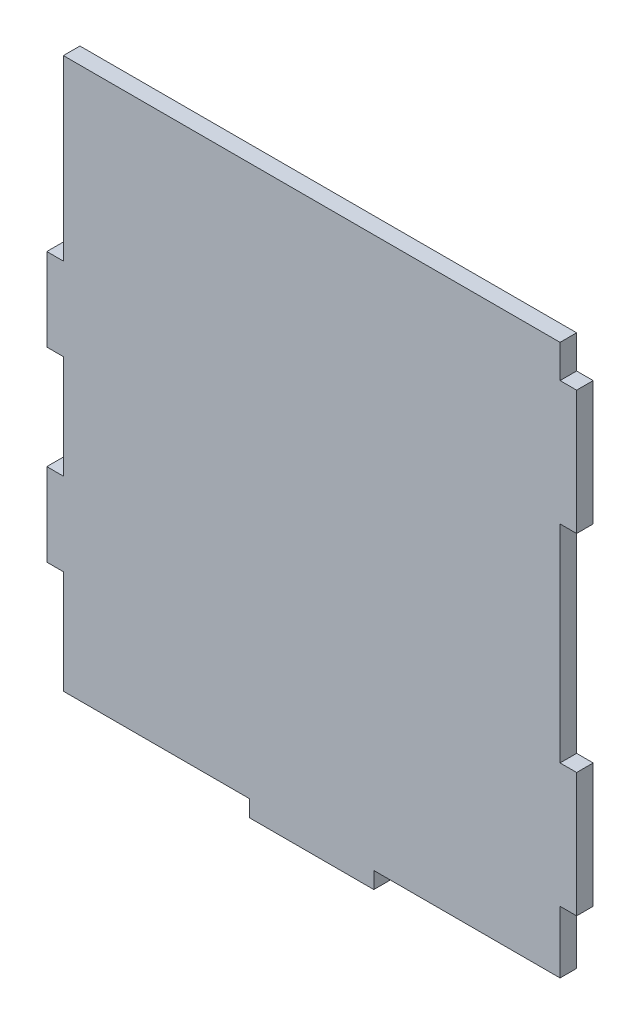
from build123d import *

# Parameters (mm, degrees)
SKETCH_1_W      = 120
SKETCH_1_H      = 133
SKETCH_1_W_2    = 4
SKETCH_1_H_2    = 20
SKETCH_1_H_3    = 30
SKETCH_1_W_3    = 30
SKETCH_1_H_4    = 4
EXTRUDE_1_DEPTH = 4


with BuildPart() as part:
    # Эскиз1 → Бобышка-Вытянуть1 (new body)
    with BuildSketch(Plane.XY):
        with Locations((60, 66.5)):
            Rectangle(SKETCH_1_W, SKETCH_1_H)
        with Locations((-2, 35)):
            Rectangle(SKETCH_1_W_2, SKETCH_1_H_2)
        with Locations((122, 30)):
            Rectangle(SKETCH_1_W_2, SKETCH_1_H_3)
        with Locations((122, 110)):
            Rectangle(SKETCH_1_W_2, SKETCH_1_H_3)
        with Locations((-2, 80)):
            Rectangle(SKETCH_1_W_2, SKETCH_1_H_2)
        with Locations((60, -2)):
            Rectangle(SKETCH_1_W_3, SKETCH_1_H_4)
    extrude(amount=EXTRUDE_1_DEPTH)


solid = part.part
